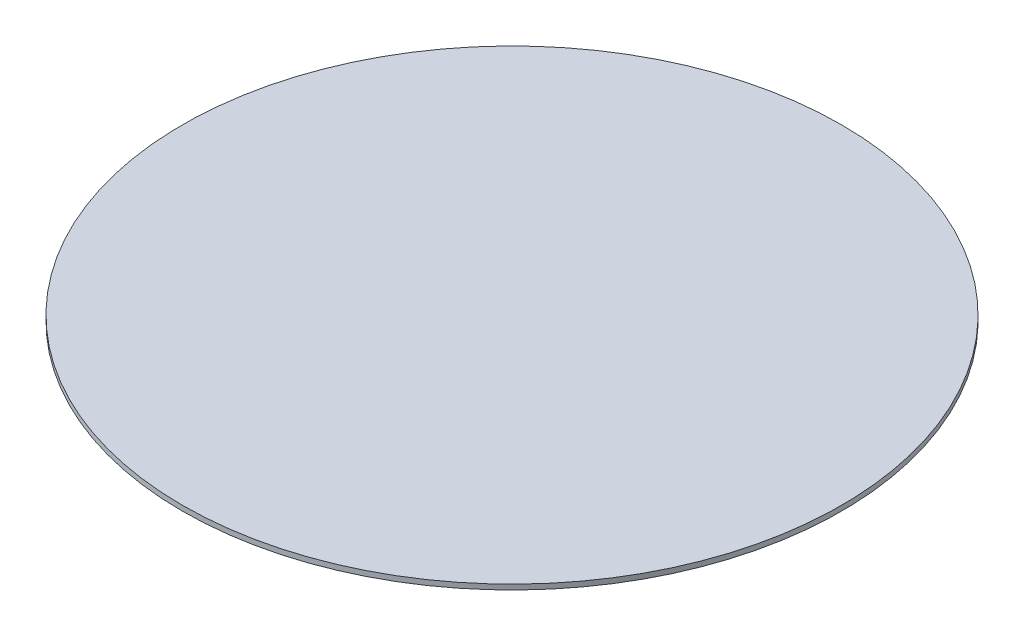
from build123d import *

# Parameters (mm, degrees)
ESQUISSE1_R        = 100
BOSS_EXTRU_1_DEPTH = 1.55


with BuildPart() as part:
    # Esquisse1 → Boss.-Extru.1 (new body)
    with BuildSketch(Plane(origin=(0, 0, 0), x_dir=(1, 0, 0), z_dir=(0, 1, 0))):
        with Locations(Location((0, 0, 0), (0, 0, 90))):
            Circle(ESQUISSE1_R)
    extrude(amount=BOSS_EXTRU_1_DEPTH)


solid = part.part
